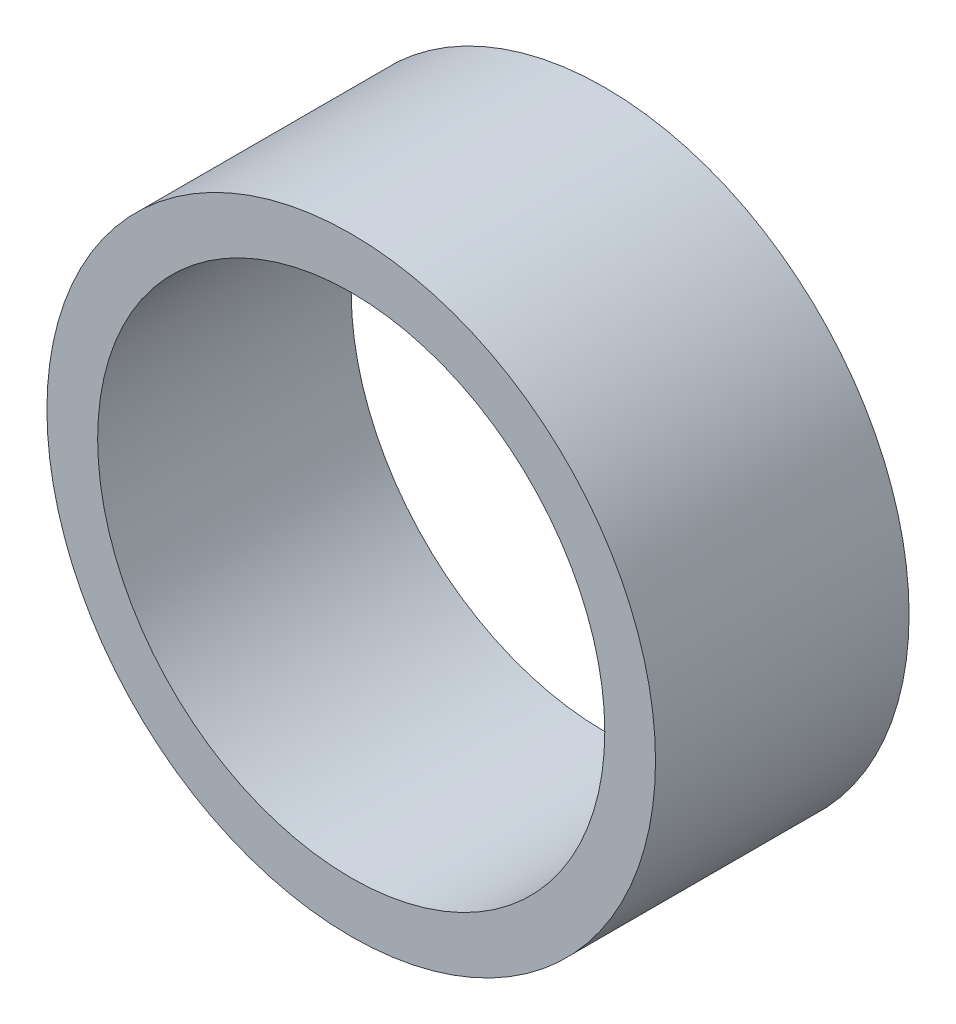
from build123d import *

# Parameters (mm, degrees)
SKETCH_1_R      = 6
SKETCH_1_R_2    = 5
EXTRUDE_1_DEPTH = 5


with BuildPart() as part:
    # 草图1 → 凸台-拉伸1 (new body)
    with BuildSketch(Plane.XY):
        Circle(SKETCH_1_R)
        Circle(SKETCH_1_R_2, mode=Mode.SUBTRACT)
    extrude(amount=EXTRUDE_1_DEPTH)


solid = part.part
